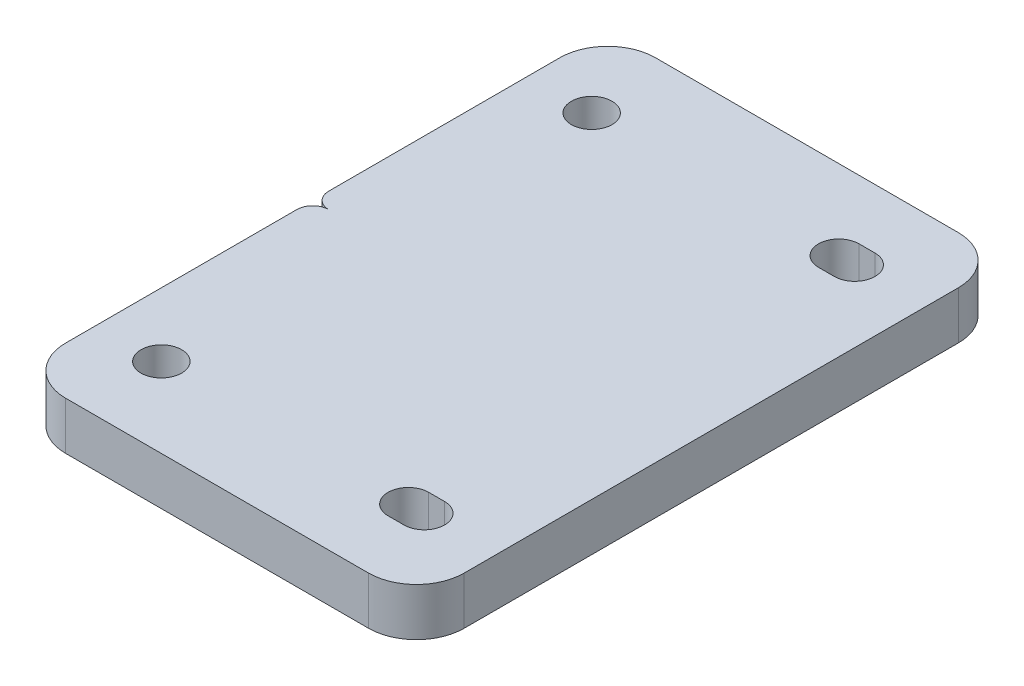
from build123d import *

# Parameters (mm, degrees)
EXTRUDE_1_DEPTH     = 6
SKETCH_2_R          = 2.55
CUT_EXTRUDE_1_DEPTH = 46.055521304
CUT_EXTRUDE_2_DEPTH = 46.055521304


with BuildPart() as part:
    # Эскиз1 → Бобышка-Вытянуть1 (new body)
    with BuildSketch(Plane(origin=(0, 0, 0), x_dir=(1, 0, 0), z_dir=(0, 1, 0))):
        with BuildLine():
            Line((-19, -37), (19, -37))
            ThreePointArc((19, -37), (23.242640687, -35.242640687), (25, -31))
            Line((25, -31), (25, 31))
            ThreePointArc((25, 31), (23.242640687, 35.242640687), (19, 37))
            Line((19, 37), (-19, 37))
            ThreePointArc((-19, 37), (-23.242640687, 35.242640687), (-25, 31))
            Line((-25, 31), (-25, -31))
            ThreePointArc((-25, -31), (-23.242640687, -35.242640687), (-19, -37))
        make_face()
    extrude(amount=EXTRUDE_1_DEPTH)

    # Эскиз2 → Вырез-Вытянуть1 (cut, through all)
    with BuildSketch(Plane.XZ):
        with Locations(Location((-17, -27, 0), (0, 0, 270))):
            Circle(SKETCH_2_R)
        with Locations(Location((-17, 27, 0), (0, 0, 90))):
            Circle(SKETCH_2_R)
        with BuildLine():
            Line((16, -29.55), (14, -29.55))
            ThreePointArc((14, -29.55), (11.45, -27), (14, -24.45))
            Line((14, -24.45), (16, -24.45))
            ThreePointArc((16, -24.45), (18.55, -27), (16, -29.55))
        make_face()
        with BuildLine():
            Line((16, 29.55), (14, 29.55))
            ThreePointArc((14, 29.55), (11.45, 27), (14, 24.45))
            Line((14, 24.45), (16, 24.45))
            ThreePointArc((16, 24.45), (18.55, 27), (16, 29.55))
        make_face()
    extrude(amount=-CUT_EXTRUDE_1_DEPTH, mode=Mode.SUBTRACT)

    # Эскиз3 → Вырез-Вытянуть2 (cut, through all)
    with BuildSketch(Plane.XZ):
        with BuildLine():
            Line((-25, -2), (-25, 2))
            ThreePointArc((-25, 2), (-24.414213562, 0.585786438), (-23, 0))
            ThreePointArc((-23, 0), (-24.414213562, -0.585786438), (-25, -2))
        make_face()
    extrude(amount=-CUT_EXTRUDE_2_DEPTH, mode=Mode.SUBTRACT)


solid = part.part
